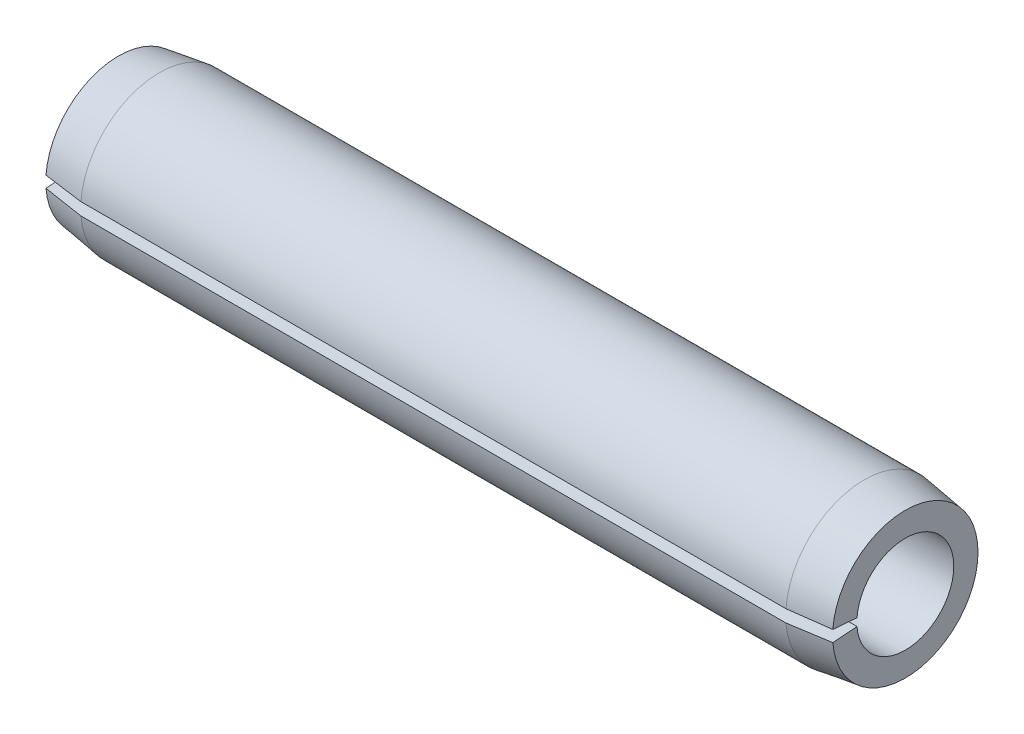
from build123d import *

# Parameters (mm, degrees)
GAP_DEPTH = 33.065928179


with BuildPart() as part:
    # Sketch1 → Base-Revolve (revolve)
    with BuildSketch(Plane.XY, mode=Mode.PRIVATE) as base_revolve_sk:
        Polygon((0, 1.9558), (31.75, 1.9558), (31.75, 2.9337), (30.099, 3.175), (1.651, 3.175), (0, 2.9337), align=None)
    revolve(base_revolve_sk.sketch.rotate(Axis((-9.525, 0, 0), (1, 0, 0)), 90), axis=Axis((-9.525, 0, 0), (1, 0, 0)))

    # Sketch2 → Gap (cut, through all)
    with BuildSketch(Plane(origin=(0, 0, 0), x_dir=(0, -1, 0), z_dir=(-1, 0, 0))):
        with BuildLine():
            Line((0, 0), (0.254089782, 3.228516785))
            ThreePointArc((0.254089782, 3.228516785), (0, 3.2385), (-0.254089782, 3.228516785))
            Line((-0.254089782, 3.228516785), (0, 0))
        make_face()
    extrude(amount=-GAP_DEPTH, mode=Mode.SUBTRACT)


solid = part.part
